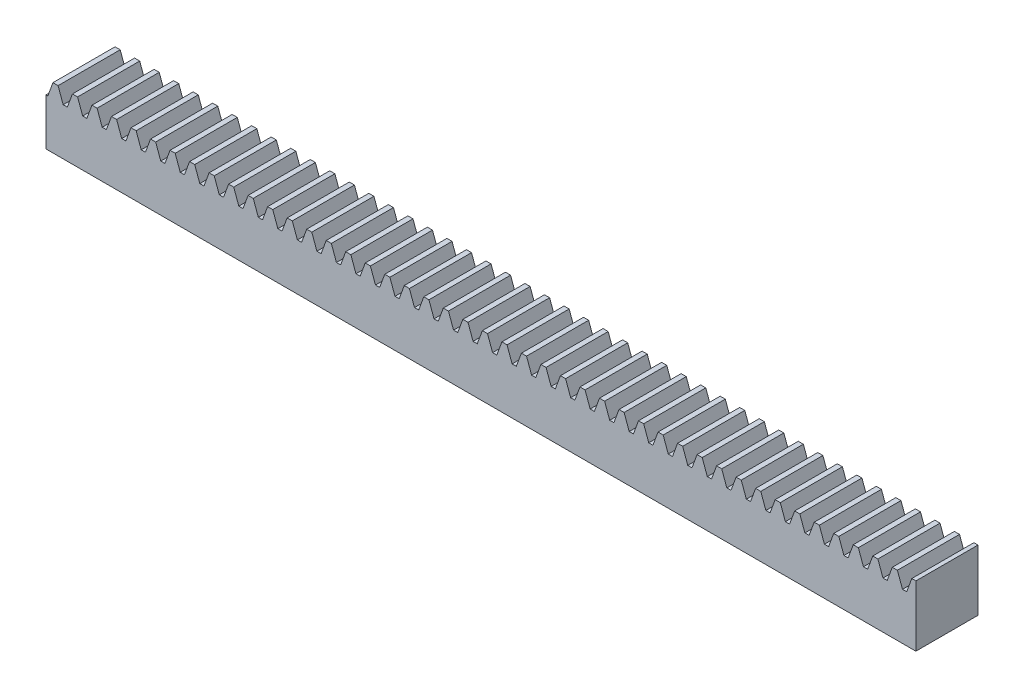
from build123d import *

# Parameters (mm, degrees)
RITNING_1_W          = 250
RITNING_1_H          = 9.8
KUGGST_NGS_MNE_DEPTH = 10
KUGGLUCKA_DEPTH      = 10
LPATTERN_COUNT       = 80
LPATTERN_PITCH       = 3.14159265
CUT_EXTRUDE1_DEPTH   = 10


with BuildPart() as part:
    # Ritning 1 → Kuggstångsämne (new body)
    with BuildSketch(Plane.XY):
        with Locations((0.9, 0)):
            Rectangle(RITNING_1_W, RITNING_1_H)
    extrude(amount=KUGGST_NGS_MNE_DEPTH)

    # Ritning 2 → Kugglucka (cut)
    with BuildSketch(Plane.XY.offset(10)):
        with BuildLine():
            Line((-124.438289352, 2.65), (-123.761710648, 2.65))
            Line((-123.761710648, 2.65), (-122.942777621, 4.9))
            Line((-122.942777621, 4.9), (-124.1, 6.057222379))
            Line((-124.1, 6.057222379), (-125.257222379, 4.9))
            add(Edge.make_bspline(
                [(-125.257222379, 4.9), (-124.984244704, 4.15), (-124.711267028, 3.4), (-124.438289352, 2.65)],
                knots=[0, 0, 0, 0, 1, 1, 1, 1], degree=3))
        make_face()
    kugglucka = extrude(amount=-KUGGLUCKA_DEPTH, mode=Mode.SUBTRACT)

    # LPattern: Kugglucka ×80
    with Locations(*[(i * LPATTERN_PITCH, 0, 0) for i in range(1, LPATTERN_COUNT)]):
        add(kugglucka, mode=Mode.SUBTRACT)

    # Sketch1 → Cut-Extrude1 (cut)
    with BuildSketch(Plane.XY.offset(10)):
        Polygon((-14.1, -4.9), (-14.1, 28.842598561), (-144.155901294, 20.311788427), (-144.155901294, -37.128999809), (-16.762469959, -41.110044539), align=None)
    extrude(amount=-CUT_EXTRUDE1_DEPTH, mode=Mode.SUBTRACT)


solid = part.part
